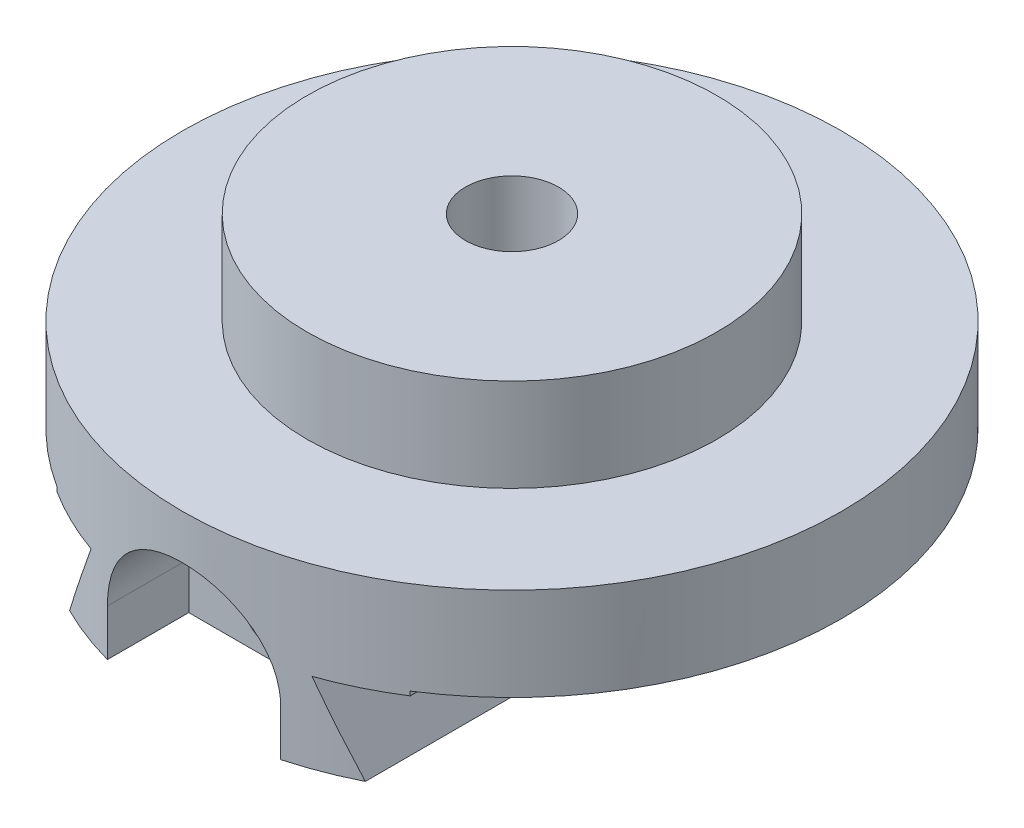
from build123d import *

# Parameters (mm, degrees)
Y_KSEKLIK_EKSTR_ZYON2_REACH                  = 120.76
Y_KSEKLIK_EKSTR_ZYON2_END_RADIUS             = 78
Y_KSEKLIK_EKSTR_ZYON2_DIRECTION_2_REACH      = 120.76
Y_KSEKLIK_EKSTR_ZYON2_DIRECTION_2_END_RADIUS = 78
KES_EKSTR_ZYON1_DEPTH                        = 22
M16_BO_LUKLU_DELIK2_D                        = 17.5
M16_BO_LUKLU_DELIK2_DEPTH                    = 55.999
M16_BO_LUKLU_DELIK2_CSINK_D                  = 17.55
M16_BO_LUKLU_DELIK2_CSINK_ANGLE              = 90
M16_BO_LUKLU_DELIK2_TIP                      = 5.257530416
KES_EKSTR_ZYON2_REACH                        = 187.785
KES_EKSTR_ZYON2_END_RADIUS                   = 22


with BuildPart() as part:
    # Çizim1 → Döndür1 (revolve)
    with BuildSketch(Plane.XY):
        Polygon((0, 0), (48.5, 0), (48.5, -22), (78, -22), (78, -44), (0, -44), align=None)
    revolve(axis=Axis((0, 0, 0), (0, -1, 0)))

    # Yükseklik-Ekstrüzyon2: up to this cylinder (the profile starts inside it)
    y_kseklik_ekstr_zyon2_end = Plane(origin=(0, -54.257115, 0), z_dir=(0, 1, 0)) * Cylinder(Y_KSEKLIK_EKSTR_ZYON2_END_RADIUS, 398.52, mode=Mode.PRIVATE)
    # Çizim2 → Yükseklik-Ekstrüzyon2 (add, up to the surface)
    with BuildSketch(Plane.XY, mode=Mode.PRIVATE) as y_kseklik_ekstr_zyon2_sk1:
        Polygon((-35, -64), (35, -64), (26.140154495, -45), (41.775578503, -45), (41.775578503, -44), (-41.775578503, -44), (-41.775578503, -45), (-26.140154495, -45), align=None)
    y_kseklik_ekstr_zyon2_tool1 = extrude(y_kseklik_ekstr_zyon2_sk1.sketch, amount=Y_KSEKLIK_EKSTR_ZYON2_REACH, mode=Mode.PRIVATE) & y_kseklik_ekstr_zyon2_end
    add(y_kseklik_ekstr_zyon2_tool1.solids().sort_by_distance((0, -54.257115, 0))[0])

    # Yükseklik-Ekstrüzyon2 direction 2: up to this cylinder (the profile starts inside it)
    y_kseklik_ekstr_zyon2_direction_2_end = Plane(origin=(0, -54.257115, 0), z_dir=(0, 1, 0)) * Cylinder(Y_KSEKLIK_EKSTR_ZYON2_DIRECTION_2_END_RADIUS, 398.52, mode=Mode.PRIVATE)
    # Çizim2 → Yükseklik-Ekstrüzyon2 direction 2 (add, up to the surface)
    with BuildSketch(Plane.XY, mode=Mode.PRIVATE) as y_kseklik_ekstr_zyon2_direction_2_sk1:
        Polygon((-35, -64), (35, -64), (26.140154495, -45), (41.775578503, -45), (41.775578503, -44), (-41.775578503, -44), (-41.775578503, -45), (-26.140154495, -45), align=None)
    y_kseklik_ekstr_zyon2_direction_2_tool1 = extrude(y_kseklik_ekstr_zyon2_direction_2_sk1.sketch, amount=-Y_KSEKLIK_EKSTR_ZYON2_DIRECTION_2_REACH, mode=Mode.PRIVATE) & y_kseklik_ekstr_zyon2_direction_2_end
    add(y_kseklik_ekstr_zyon2_direction_2_tool1.solids().sort_by_distance((0, -54.257115, 0))[0])

    # Çizim4 → Kes-Döndür1 (revolve, cut)
    with BuildSketch(Plane.XY):
        Polygon((0, 0), (11, 0), (11, -21.868883424), (22, -22), (22, -64), (0, -64), align=None)
    revolve(axis=Axis((0, 0, 0), (0, -1, 0)), mode=Mode.SUBTRACT)

    # Çizim6 → Kes-Ekstrüzyon1 (cut)
    with BuildSketch(Plane.XY.offset(78)):
        with BuildLine():
            Line((-20.5, -53), (-20.5, -64))
            Line((-20.5, -64), (0, -64))
            Line((0, -64), (20.5, -64))
            Line((20.5, -64), (20.5, -53))
            ThreePointArc((20.5, -53), (0, -32.5), (-20.5, -53))
        make_face()
    extrude(amount=-KES_EKSTR_ZYON1_DEPTH, mode=Mode.SUBTRACT)

    # M16 Boşluklu Delik2
    with Locations(Plane(origin=(0, -53, 56), x_dir=(1, 0, 0), z_dir=(0, 0, 1))):
        with Locations((0, 0)):
            CounterSinkHole(M16_BO_LUKLU_DELIK2_D / 2, M16_BO_LUKLU_DELIK2_CSINK_D / 2, depth=M16_BO_LUKLU_DELIK2_DEPTH, counter_sink_angle=M16_BO_LUKLU_DELIK2_CSINK_ANGLE)
            with Locations((0, 0, -(M16_BO_LUKLU_DELIK2_DEPTH + M16_BO_LUKLU_DELIK2_TIP / 2))):  # 118° drill point
                Cone(0, M16_BO_LUKLU_DELIK2_D / 2, M16_BO_LUKLU_DELIK2_TIP, mode=Mode.SUBTRACT)

    # Kes-Ekstrüzyon2: up to this cylinder (the profile starts outside it)
    kes_ekstr_zyon2_end = Plane(origin=(0, -52.571949, 0), z_dir=(0, 1, 0)) * Cylinder(KES_EKSTR_ZYON2_END_RADIUS, 420.57, mode=Mode.PRIVATE)
    # Çizim10 → Kes-Ekstrüzyon2 (cut, up to the surface)
    with BuildSketch(Plane(origin=(0, 0, -78), x_dir=(-1, 0, 0), z_dir=(0, 0, -1)), mode=Mode.PRIVATE) as kes_ekstr_zyon2_sk1:
        with BuildLine():
            Line((-14.5, -53), (-14.5, -64))
            Line((-14.5, -64), (14.5, -64))
            Line((14.5, -64), (14.5, -53))
            ThreePointArc((14.5, -53), (0, -38.5), (-14.5, -53))
        make_face()
    kes_ekstr_zyon2_tool1 = extrude(kes_ekstr_zyon2_sk1.sketch, amount=-KES_EKSTR_ZYON2_REACH, mode=Mode.PRIVATE) - kes_ekstr_zyon2_end
    add(kes_ekstr_zyon2_tool1.solids().sort_by_distance((0, -52.571949, -78))[0], mode=Mode.SUBTRACT)


solid = part.part
